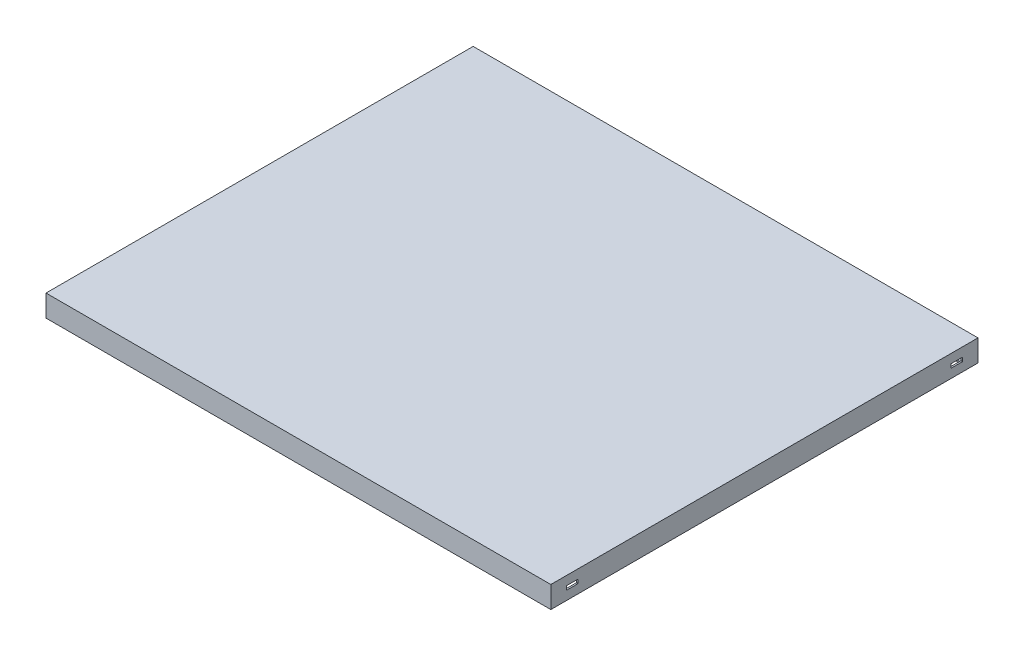
from build123d import *

# Parameters (mm, degrees)
CROQUIS1_W              = 650
CROQUIS1_H              = 550
SALIENTE_EXTRUIR1_DEPTH = 28
VACIADO1_T              = -2
CROQUIS2_W              = 646
CROQUIS2_H              = 2
SALIENTE_EXTRUIR2_DEPTH = 10
CROQUIS3_W              = 646
CROQUIS3_H              = 2
SALIENTE_EXTRUIR3_DEPTH = 10
CORTAR_EXTRUIR1_REACH   = 708.335
CROQUIS4_W              = 15
CROQUIS4_H              = 5


with BuildPart() as part:
    # Croquis1 → Saliente-Extruir1 (new body)
    with BuildSketch(Plane(origin=(0, 0, 0), x_dir=(1, 0, 0), z_dir=(0, 1, 0))):
        Rectangle(CROQUIS1_W, CROQUIS1_H)
    extrude(amount=SALIENTE_EXTRUIR1_DEPTH)

    # Vaciado1
    vaciado1_openings = [part.faces().sort_by_distance(p)[0] for p in [
        (0, 0, 0),
    ]]
    offset(amount=VACIADO1_T, openings=vaciado1_openings, kind=Kind.INTERSECTION)

    # Croquis2 → Saliente-Extruir2 (add)
    with BuildSketch(Plane(origin=(0, 0, 273), x_dir=(-1, 0, 0), z_dir=(0, 0, -1))):
        with Locations((0, 1)):
            Rectangle(CROQUIS2_W, CROQUIS2_H)
    extrude(amount=SALIENTE_EXTRUIR2_DEPTH)

    # Croquis3 → Saliente-Extruir3 (add)
    with BuildSketch(Plane.XY.offset(-273)):
        with Locations((0, 1)):
            Rectangle(CROQUIS3_W, CROQUIS3_H)
    extrude(amount=SALIENTE_EXTRUIR3_DEPTH)

    # Cortar-Extruir1: up to this face of the body (flat: up to its plane)
    cortar_extruir1_end = Plane(part.part.faces().sort_by_distance((325, 14, 0))[0])
    # Croquis4 → Cortar-Extruir1 (cut, up to the picked face)
    with BuildSketch(Plane.ZY.offset(325), mode=Mode.PRIVATE) as cortar_extruir1_sk1:
        with Locations((-247.5, 14)):
            Rectangle(CROQUIS4_W, CROQUIS4_H)
    cortar_extruir1_tool1 = split(extrude(cortar_extruir1_sk1.sketch, amount=-CORTAR_EXTRUIR1_REACH, mode=Mode.PRIVATE), bisect_by=cortar_extruir1_end, keep=Keep.BOTH, mode=Mode.PRIVATE)
    # Croquis4 → Cortar-Extruir1 (cut, up to the picked face)
    with BuildSketch(Plane.ZY.offset(325), mode=Mode.PRIVATE) as cortar_extruir1_sk2:
        with Locations((247.5, 14)):
            Rectangle(CROQUIS4_W, CROQUIS4_H)
    cortar_extruir1_tool2 = split(extrude(cortar_extruir1_sk2.sketch, amount=-CORTAR_EXTRUIR1_REACH, mode=Mode.PRIVATE), bisect_by=cortar_extruir1_end, keep=Keep.BOTH, mode=Mode.PRIVATE)
    add(cortar_extruir1_tool1.solids().sort_by(Axis((-325, 14, -247.5), (1, 0, 0)))[0], mode=Mode.SUBTRACT)
    add(cortar_extruir1_tool2.solids().sort_by(Axis((-325, 14, 247.5), (1, 0, 0)))[0], mode=Mode.SUBTRACT)


solid = part.part
